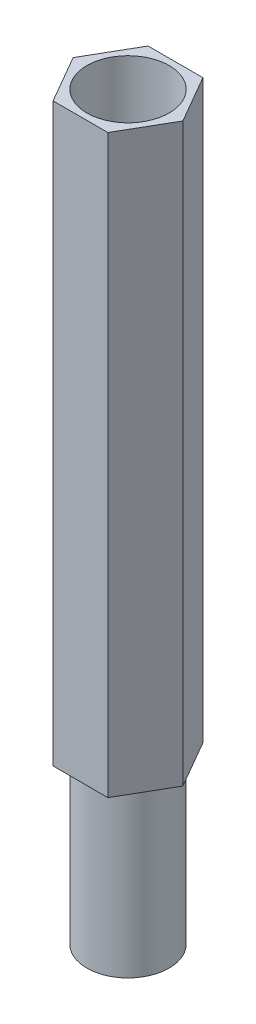
from build123d import *

# Parameters (mm, degrees)
EXTRUDE_1_DEPTH           = 21
SKETCH_2_W                = 1.5
SKETCH_2_H                = 6
HOLE_WIZARD_3_0_3_1_D     = 3
HOLE_WIZARD_3_0_3_1_DEPTH = 5


with BuildPart() as part:
    # 草图1 → 凸台-拉伸1 (new body)
    with BuildSketch(Plane.XZ):
        Polygon((-1, 1.732050808), (-2, 0), (-1, -1.732050808), (1, -1.732050808), (2, 0), (1, 1.732050808), align=None)
    extrude(amount=-EXTRUDE_1_DEPTH)

    # 草图2 → 旋转1 (revolve)
    with BuildSketch(Plane.XY, mode=Mode.PRIVATE) as revolve_1_sk:
        with Locations((0.75, -3)):
            Rectangle(SKETCH_2_W, SKETCH_2_H)
    revolve(revolve_1_sk.sketch.rotate(Axis((0, 0, 0), (0, -1, 0)), 270), axis=Axis((0, 0, 0), (0, -1, 0)))

    # Ø3.0 (3) 直径孔1
    with Locations(Plane(origin=(0, 21, 0), x_dir=(1, 0, 0), z_dir=(0, 1, 0))):
        with Locations((0, 0)):
            Hole(HOLE_WIZARD_3_0_3_1_D / 2, depth=HOLE_WIZARD_3_0_3_1_DEPTH)


solid = part.part
